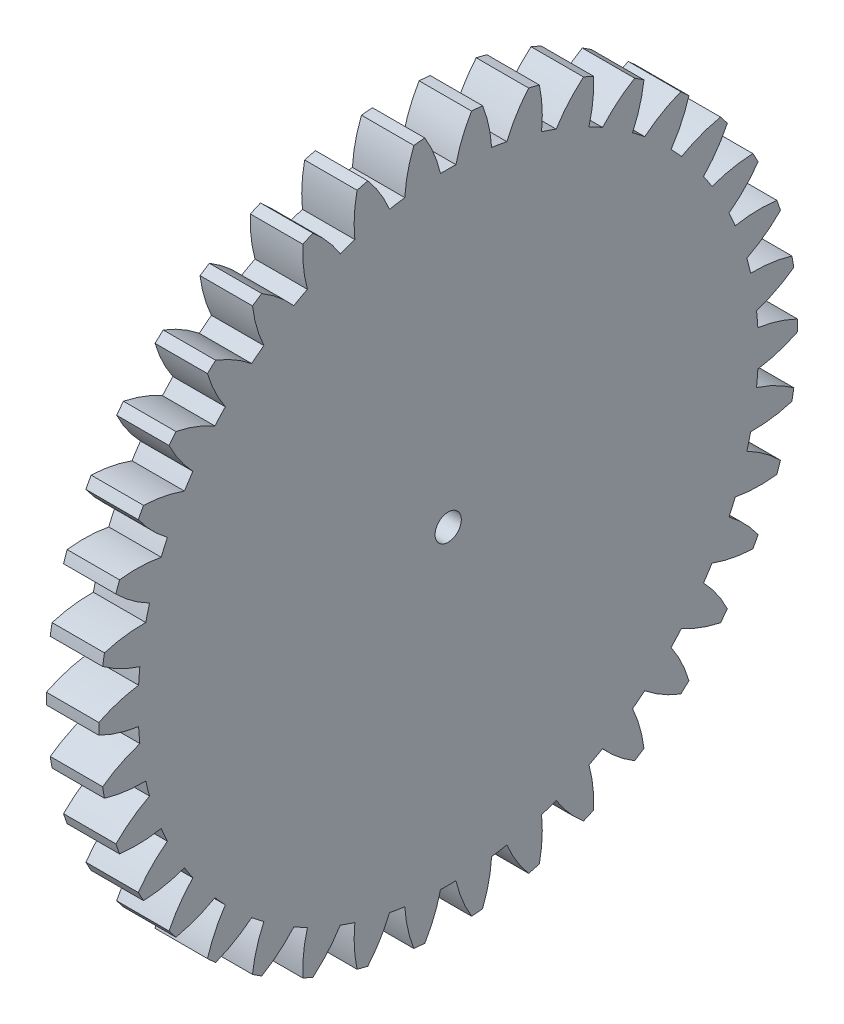
from build123d import *

# Parameters (mm, degrees)
BASPROSKE_W     = 12
BASPROSKE_H     = 80
TOOTHCUT_DEPTH  = 114.771701227
TEETHCUTS_COUNT = 38
TEETHCUTS_ANGLE = 350.526315789
BORSKE_R        = 3
BORE_DEPTH      = 50.0000508


with BuildPart() as part:
    # BasProSke → Base-Revolve (revolve)
    with BuildSketch(Plane(origin=(0, 0, 0), x_dir=(1, 0, 0), z_dir=(0, 1, 0)), mode=Mode.PRIVATE) as base_revolve_sk:
        with Locations((6, 40)):
            Rectangle(BASPROSKE_W, BASPROSKE_H)
    revolve(base_revolve_sk.sketch.rotate(Axis((-10, 0, 0), (1, 0, 0)), 180), axis=Axis((-10, 0, 0), (1, 0, 0)))

    # TooCutSke → ToothCut (cut, through all)
    with BuildSketch(Plane(origin=(0, 0, 0), x_dir=(0, 0, -1), z_dir=(1, 0, 0))):
        with BuildLine():
            ThreePointArc((1.765889814, 70.977035964), (0, 70.999), (-1.765889814, 70.977035964))
            ThreePointArc((-1.765889814, 70.977035964), (-3.209517001, 75.553620901), (-5.355352541, 79.846007066))
            ThreePointArc((-5.355352541, 79.846007066), (0, 80.0254), (5.355352541, 79.846007066))
            ThreePointArc((5.355352541, 79.846007066), (3.209517001, 75.553620901), (1.765889814, 70.977035964))
        make_face()
    toothcut = extrude(amount=TOOTHCUT_DEPTH, mode=Mode.SUBTRACT)

    # TeethCuts: ToothCut ×38 about axis
    teethcuts_axis = Axis((-10, 0, 0), (1, 0, 0))
    for i in range(1, TEETHCUTS_COUNT):
        add(toothcut.rotate(teethcuts_axis, i * TEETHCUTS_ANGLE / (TEETHCUTS_COUNT - 1)), mode=Mode.SUBTRACT)

    # BorSke → Bore (cut, symmetric)
    with BuildSketch(Plane(origin=(0, 0, 0), x_dir=(0, 0, -1), z_dir=(1, 0, 0))):
        with Locations(Location((0, 0, 0), (0, 0, 180))):
            Circle(BORSKE_R)
    extrude(amount=BORE_DEPTH, both=True, mode=Mode.SUBTRACT)


solid = part.part
